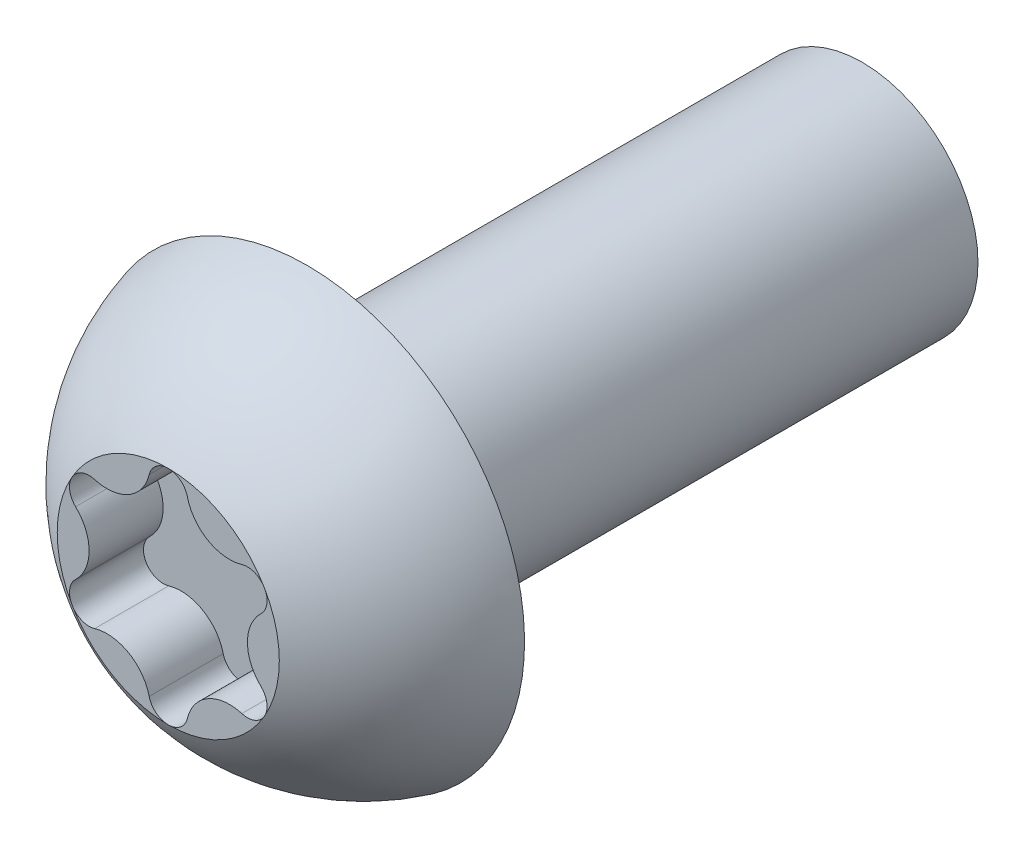
from build123d import *

# Parameters (mm, degrees)
ENL_V_MAT_EXTRU_1_DEPTH = 0.8


with BuildPart() as part:
    # Esquisse1 → Révolution1 (revolve)
    with BuildSketch(Plane(origin=(0, 0, 0), x_dir=(0, 0, -1), z_dir=(1, 0, 0))):
        with BuildLine():
            Line((-1.5, 0), (-1.5, 1.2))
            ThreePointArc((-1.5, 1.2), (-0.866492752, 1.926947067), (0, 2.35))
            Line((0, 2.35), (0, 1.25))
            Line((0, 1.25), (6, 1.25))
            Line((6, 1.25), (6, 0))
            Line((6, 0), (-1.5, 0))
        make_face()
    revolve(axis=Axis((0, 0, 1.5), (0, 0, 1)))

    # Esquisse2 → Enlèv. mat.-Extru.1 (cut)
    with BuildSketch(Plane.XY.offset(1.5)):
        with BuildLine():
            ThreePointArc((-0.206338407, 1.037333225), (0, 1.2), (0.206338407, 1.037333225))
            ThreePointArc((0.206338407, 1.037333225), (0.427729629, 0.74084945), (0.795187721, 0.697360915))
            ThreePointArc((0.795187721, 0.697360915), (1.039230485, 0.6), (1.001526129, 0.33997231))
            ThreePointArc((1.001526129, 0.33997231), (0.855459258, 0), (1.001526129, -0.33997231))
            ThreePointArc((1.001526129, -0.33997231), (1.039230485, -0.6), (0.795187721, -0.697360915))
            ThreePointArc((0.795187721, -0.697360915), (0.427729629, -0.74084945), (0.206338407, -1.037333225))
            ThreePointArc((0.206338407, -1.037333225), (0, -1.2), (-0.206338407, -1.037333225))
            ThreePointArc((-0.206338407, -1.037333225), (-0.427729629, -0.74084945), (-0.795187721, -0.697360915))
            ThreePointArc((-0.795187721, -0.697360915), (-1.039230485, -0.6), (-1.001526129, -0.33997231))
            ThreePointArc((-1.001526129, -0.33997231), (-0.855459258, 0), (-1.001526129, 0.33997231))
            ThreePointArc((-1.001526129, 0.33997231), (-1.039230485, 0.6), (-0.795187721, 0.697360915))
            ThreePointArc((-0.795187721, 0.697360915), (-0.427729629, 0.74084945), (-0.206338407, 1.037333225))
        make_face()
    extrude(amount=-ENL_V_MAT_EXTRU_1_DEPTH, mode=Mode.SUBTRACT)


solid = part.part
